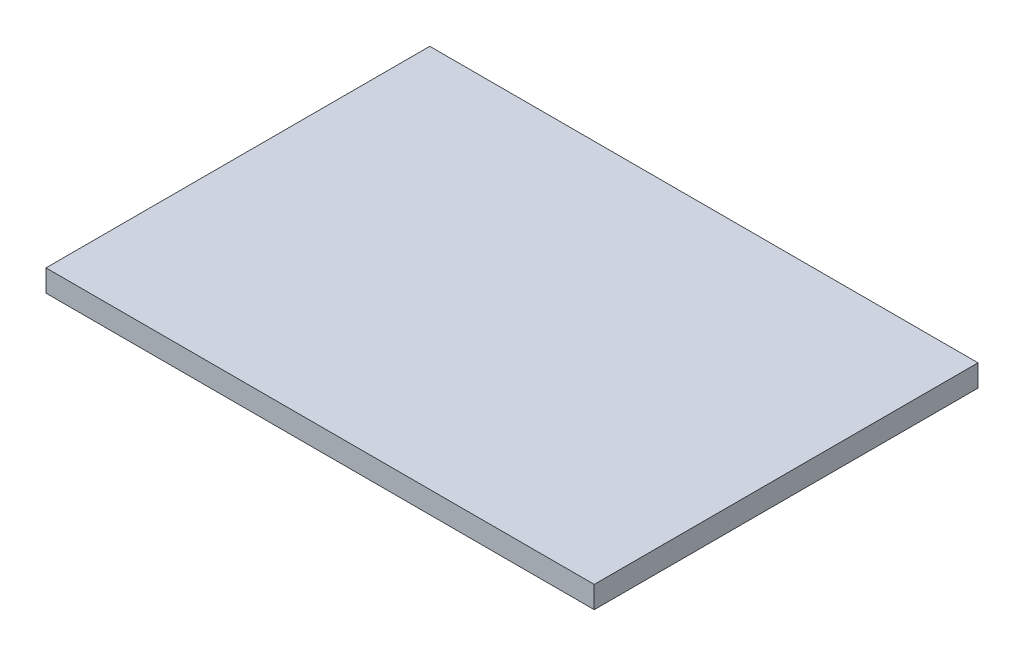
from build123d import *

# Parameters (mm, degrees)
SKETCH1_W           = 500
SKETCH1_H           = 350
BOSS_EXTRUDE1_DEPTH = 20


with BuildPart() as part:
    # Sketch1 → Boss-Extrude1 (new body)
    with BuildSketch(Plane(origin=(0, 0, 0), x_dir=(1, 0, 0), z_dir=(0, 1, 0))):
        Rectangle(SKETCH1_W, SKETCH1_H)
    extrude(amount=BOSS_EXTRUDE1_DEPTH)


solid = part.part
